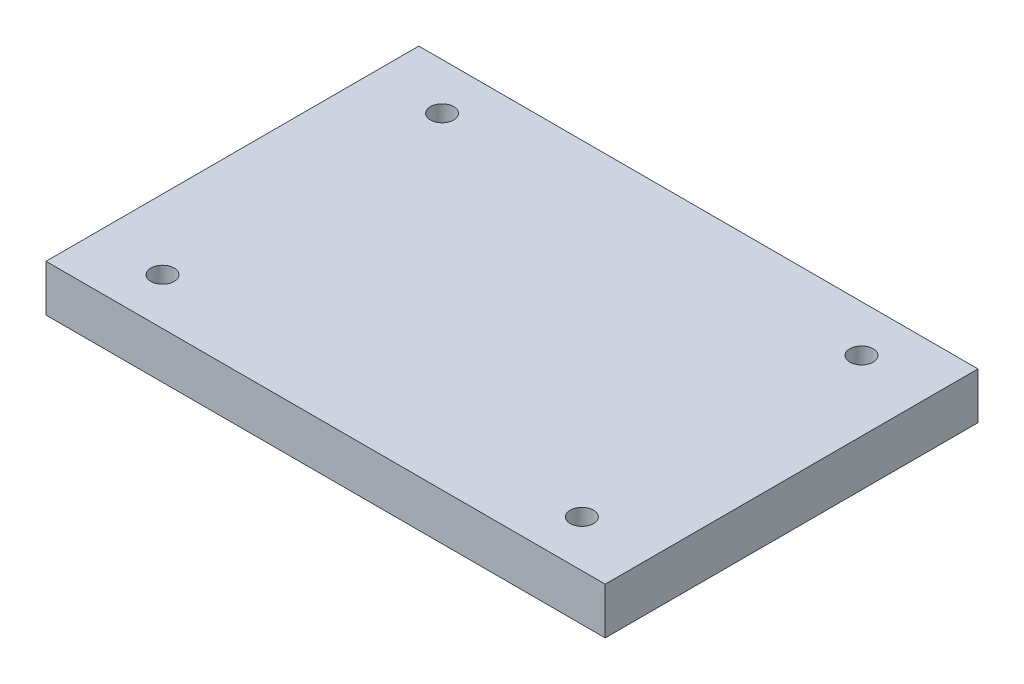
from build123d import *

# Parameters (mm, degrees)
SKETCH_1_W          = 240
SKETCH_1_H          = 160
EXTRUDE_1_DEPTH     = 20
SKETCH_2_R          = 5
CUT_EXTRUDE_1_DEPTH = 20


with BuildPart() as part:
    # 草图1 → 凸台-拉伸1 (new body)
    with BuildSketch(Plane(origin=(0, 0, 0), x_dir=(1, 0, 0), z_dir=(0, 1, 0))):
        Rectangle(SKETCH_1_W, SKETCH_1_H)
    extrude(amount=-EXTRUDE_1_DEPTH)

    # 草图2 → 切除-拉伸1 (cut)
    with BuildSketch(Plane(origin=(0, 0, 0), x_dir=(1, 0, 0), z_dir=(0, 1, 0))):
        with Locations(Location((90, 60, 0), (0, 0, 270))):
            Circle(SKETCH_2_R)
        with Locations(Location((-90, 60, 0), (0, 0, 270))):
            Circle(SKETCH_2_R)
        with Locations(Location((90, -60, 0), (0, 0, 270))):
            Circle(SKETCH_2_R)
        with Locations(Location((-90, -60, 0), (0, 0, 270))):
            Circle(SKETCH_2_R)
    extrude(amount=-CUT_EXTRUDE_1_DEPTH, mode=Mode.SUBTRACT)


solid = part.part
